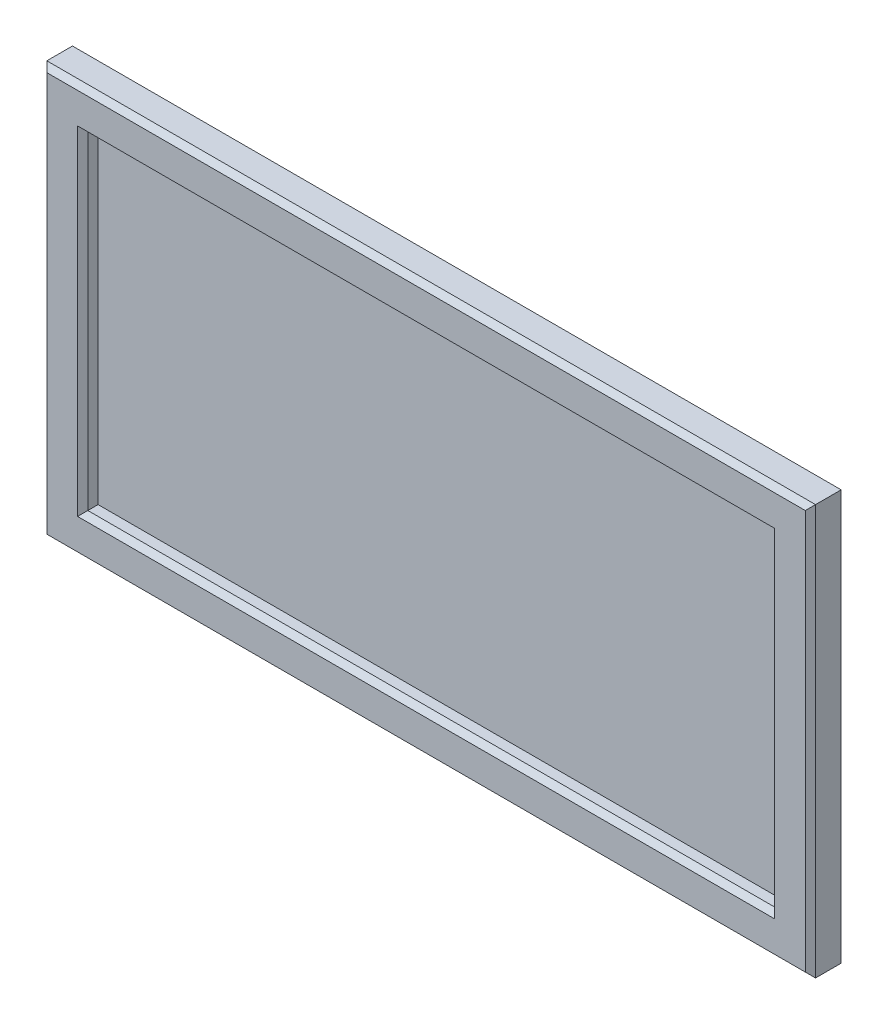
from build123d import *

# Parameters (mm, degrees)
SKETCH_1_W      = 1500
SKETCH_1_H      = 800
SKETCH_1_W_2    = 1340
SKETCH_1_H_2    = 640
EXTRUDE_1_DEPTH = 60
CHAMFER_1_SIZE  = 10
EXTRUDE_START   = -20
SKETCH_2_W      = 1415.288510093
SKETCH_2_H      = 700.361163677
EXTRUDE_2_DEPTH = 10


with BuildPart() as part:
    # Эскиз1 → Бобышка-Вытянуть1 (new body)
    with BuildSketch(Plane.XY):
        with Locations((750, 400)):
            Rectangle(SKETCH_1_W, SKETCH_1_H)
        with Locations((750, 400)):
            Rectangle(SKETCH_1_W_2, SKETCH_1_H_2, mode=Mode.SUBTRACT)
    extrude(amount=EXTRUDE_1_DEPTH)

    # Фаска1
    chamfer_1_edges = [part.edges().sort_by_distance(p)[0] for p in [
        (1500, 400, 60),
        (750, 80, 60),
        (750, 800, 60),
        (1420, 400, 60),
        (750, 720, 60),
        (80, 400, 60),
        (0, 400, 60),
        (750, 0, 60),
    ]]
    chamfer(chamfer_1_edges, length=CHAMFER_1_SIZE)


with BuildPart() as body_2:
    # Эскиз2 → Бобышка-Вытянуть2 (new body)
    with BuildSketch(Plane(origin=(0, 0, 0), x_dir=(-1, 0, 0), z_dir=(0, 0, -1)).offset(EXTRUDE_START)):
        with Locations((-749.50399885, 387.693963309)):
            Rectangle(SKETCH_2_W, SKETCH_2_H)
    extrude(amount=-EXTRUDE_2_DEPTH)


solid = Compound([part.part, body_2.part])
